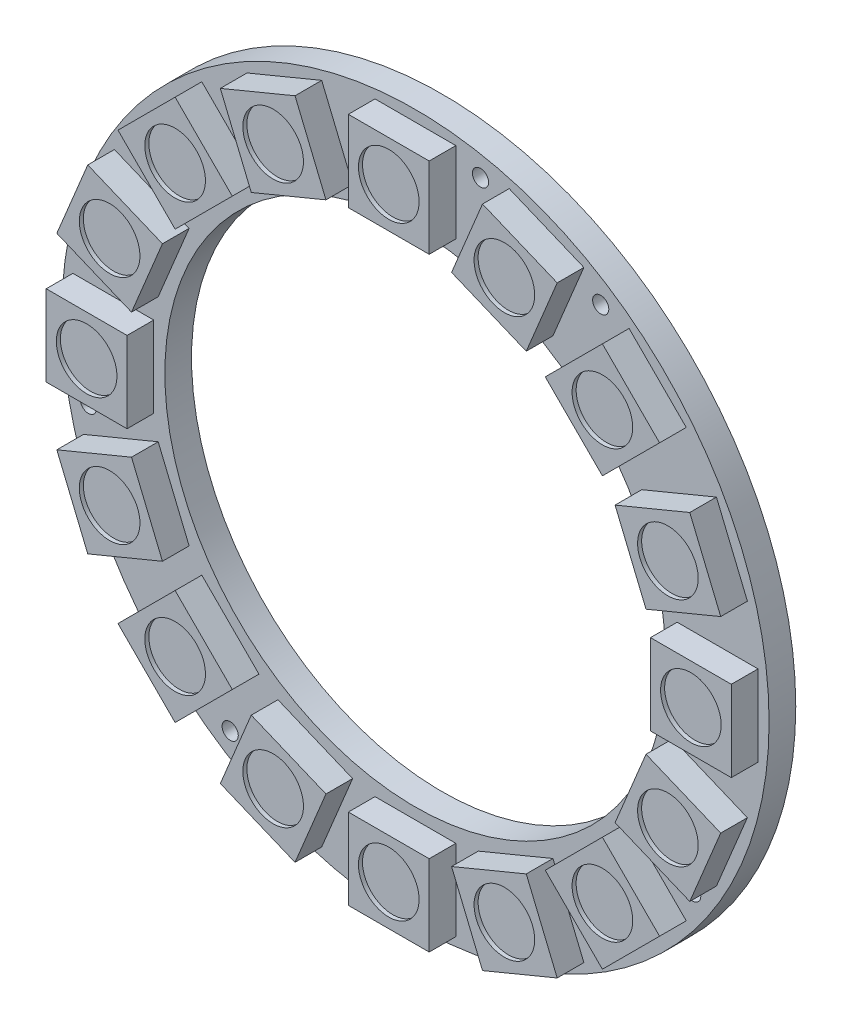
from build123d import *

# Parameters (mm, degrees)
SKETCH1_R           = 22.225
SKETCH1_R_2         = 15.748
BOSS_EXTRUDE1_DEPTH = 1.6764
SKETCH2_W           = 5.08
SKETCH2_H           = 5.08
BOSS_EXTRUDE2_DEPTH = 1.6764
SKETCH3_R           = 1.905
CUT_EXTRUDE1_DEPTH  = 0.254
CIRPATTERN1_COUNT   = 16
SKETCH4_R           = 0.508
CUT_EXTRUDE2_DEPTH  = 32.475570955
CIRPATTERN2_COUNT   = 16


with BuildPart() as part:
    # Sketch1 → Boss-Extrude1 (new body)
    with BuildSketch(Plane.XY):
        Circle(SKETCH1_R)
        Circle(SKETCH1_R_2, mode=Mode.SUBTRACT)
    extrude(amount=BOSS_EXTRUDE1_DEPTH)

    # Sketch2 → Boss-Extrude2 (add)
    with BuildSketch(Plane.XY.offset(1.6764)):
        with Locations((0, 18.9865)):
            Rectangle(SKETCH2_W, SKETCH2_H)
    boss_extrude2 = extrude(amount=BOSS_EXTRUDE2_DEPTH)

    # Sketch3 → Cut-Extrude1 (cut)
    with BuildSketch(Plane.XY.offset(3.3528)):
        with Locations((0, 18.9865)):
            Circle(SKETCH3_R)
    cut_extrude1 = extrude(amount=-CUT_EXTRUDE1_DEPTH, mode=Mode.SUBTRACT)

    # CirPattern1: Boss-Extrude2, Cut-Extrude1 ×16 about axis
    cirpattern1_axis = Axis((0, 0, 0), (0, 0, 1))
    add([boss_extrude2.rotate(cirpattern1_axis, i * 360 / CIRPATTERN1_COUNT) for i in range(1, CIRPATTERN1_COUNT)])
    add([cut_extrude1.rotate(cirpattern1_axis, i * 360 / CIRPATTERN1_COUNT) for i in range(1, CIRPATTERN1_COUNT)], mode=Mode.SUBTRACT)

    # Sketch4 → Cut-Extrude2 (cut, through all)
    with BuildSketch(Plane.XY.offset(1.6764)):
        with Locations((4.088117698, 20.552355551)):
            Circle(SKETCH4_R)
    cut_extrude2 = extrude(amount=-CUT_EXTRUDE2_DEPTH, mode=Mode.SUBTRACT)

    # CirPattern2: Cut-Extrude2 ×16 about axis, 10 skipped
    cirpattern2_axis = Axis((0, 0, 0), (0, 0, 1))
    add([cut_extrude2.rotate(cirpattern2_axis, i * 360 / CIRPATTERN2_COUNT) for i in range(1, CIRPATTERN2_COUNT) if i not in (1, 2, 3, 4, 6, 8, 9, 12, 13, 14)], mode=Mode.SUBTRACT)


solid = part.part
